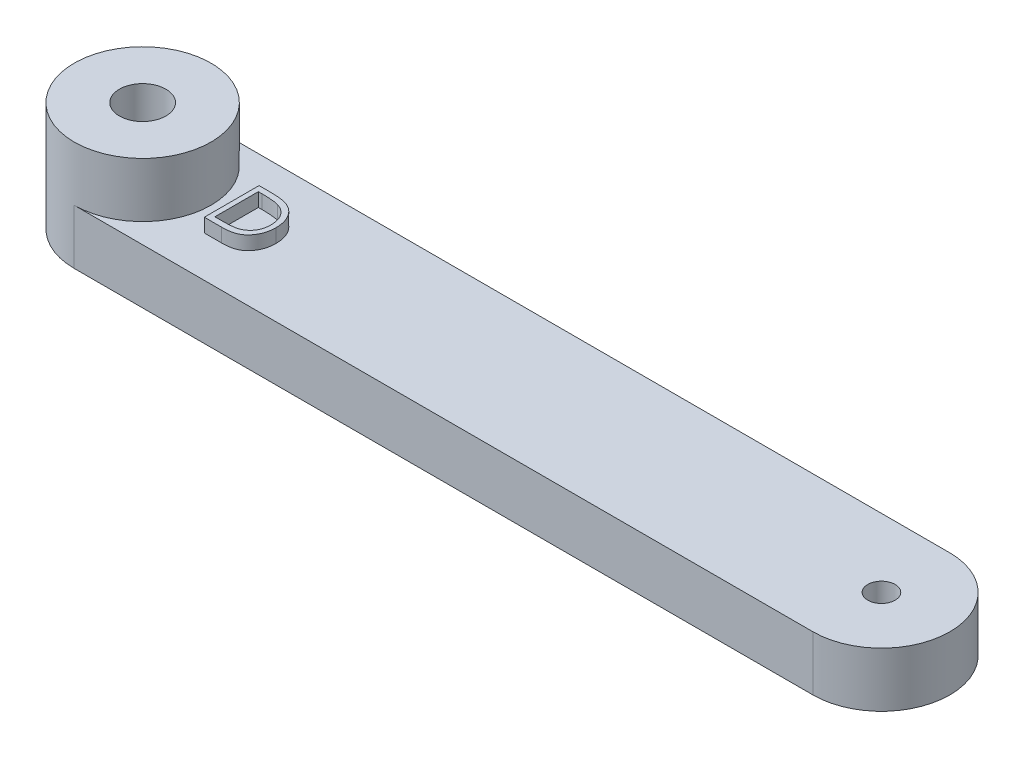
from build123d import *

# Parameters (mm, degrees)
RESSALTO_EXTRUS_O1_DEPTH = 2
ESBO_O4_R                = 2.5
RESSALTO_EXTRUS_O2_DEPTH = 2
ESBO_O2_R                = 0.85
CORTE_EXTRUS_O1_DEPTH    = 17.680827318
CORTE_EXTRUS_O2_REACH    = 18.317
ESBO_O3_R                = 0.5
RESSALTO_EXTRUS_O3_DEPTH = 0.5


with BuildPart() as part:
    # Esboço1 → Ressalto-extrusão1 (new body)
    with BuildSketch(Plane(origin=(0, 0, 0), x_dir=(1, 0, 0), z_dir=(0, 1, 0))):
        with BuildLine():
            Line((-13.5, 2.5), (13.5, 2.5))
            ThreePointArc((13.5, 2.5), (16, 0), (13.5, -2.5))
            Line((13.5, -2.5), (-13.5, -2.5))
            ThreePointArc((-13.5, -2.5), (-16, 0), (-13.5, 2.5))
        make_face()
    extrude(amount=RESSALTO_EXTRUS_O1_DEPTH)

    # Esboço4 → Ressalto-extrusão2 (add)
    with BuildSketch(Plane(origin=(0, 2, 0), x_dir=(1, 0, 0), z_dir=(0, 1, 0))):
        with Locations(Location((-13.5, 0, 0), (0, 0, 270))):
            Circle(ESBO_O4_R)
    extrude(amount=RESSALTO_EXTRUS_O2_DEPTH)

    # Esboço2 → Corte-extrusão1 (cut, through all)
    with BuildSketch(Plane(origin=(0, 4, 0), x_dir=(1, 0, 0), z_dir=(0, 1, 0))):
        with Locations(Location((-13.5, 0, 0), (0, 0, 270))):
            Circle(ESBO_O2_R)
    extrude(amount=-CORTE_EXTRUS_O1_DEPTH, mode=Mode.SUBTRACT)

    # Esboço3 → Corte-extrusão2 (cut, up to next)
    with BuildSketch(Plane(origin=(0, 2, 0), x_dir=(1, 0, 0), z_dir=(0, 1, 0)), mode=Mode.PRIVATE) as corte_extrus_o2_sk1:
        with Locations(Location((13.5, 0, 0), (0, 0, 270))):
            Circle(ESBO_O3_R)
    corte_extrus_o2_tool1 = extrude(corte_extrus_o2_sk1.sketch, amount=-CORTE_EXTRUS_O2_REACH, mode=Mode.PRIVATE) & part.part
    add(corte_extrus_o2_tool1.solids().sort_by_distance((13.5, 2, 0))[0], mode=Mode.SUBTRACT)

    # Esboço5 → Ressalto-extrusão3 (add)
    with BuildSketch(Plane(origin=(0, 2, 0), x_dir=(1, 0, 0), z_dir=(0, 1, 0))):
        with BuildLine():
            Line((-10.245767212, -1), (-10.245767212, 1))
            Line((-10.245767212, 1), (-9.841921058, 1))
            add(Edge.make_bspline(
                [(-9.841921058, 1), (-9.806795922, 0.999747103), (-9.738934342, 0.999258507), (-9.640870086, 0.996160569), (-9.550136507, 0.990680303), (-9.467032017, 0.982697717), (-9.391328467, 0.972895983), (-9.323237834, 0.960610038), (-9.262408038, 0.946102512), (-9.224996929, 0.933733683), (-9.207305673, 0.927884615)],
                knots=[0, 0, 0, 0, 1.314313732, 2.53924729, 3.670748893, 4.714932338, 5.66265055, 6.526160246, 7.303039223, 8, 8, 8, 8], degree=3))
            add(Edge.make_bspline(
                [(-9.207305673, 0.927884615), (-9.184165822, 0.919067069), (-9.138410855, 0.90163193), (-9.073263928, 0.868742615), (-9.011935149, 0.831477985), (-8.954095638, 0.789788921), (-8.901066594, 0.742495007), (-8.850776368, 0.691605244), (-8.80528224, 0.63526905), (-8.763620356, 0.574654771), (-8.726057122, 0.510476455), (-8.693406175, 0.442856393), (-8.666289607, 0.372137989), (-8.643779192, 0.298517904), (-8.626038359, 0.22183426), (-8.613934398, 0.141997765), (-8.605950975, 0.059323942), (-8.60514866, 0.003224249), (-8.604741571, -0.025240385)],
                knots=[0, 0, 0, 0, 0.984719456, 1.947108742, 2.898477687, 3.838006223, 4.779231079, 5.722358779, 6.681677486, 7.655904652, 8.64651281, 9.637519902, 10.640069247, 11.656948941, 12.698408672, 13.768548281, 14.867775369, 16, 16, 16, 16], degree=3))
            add(Edge.make_bspline(
                [(-8.604741571, -0.025240385), (-8.605100981, -0.049961092), (-8.605809236, -0.098675829), (-8.612168845, -0.170470626), (-8.621412456, -0.240135524), (-8.635723426, -0.307338781), (-8.653096291, -0.372669192), (-8.675361521, -0.435430474), (-8.700867518, -0.496198365), (-8.730610306, -0.554151209), (-8.763262526, -0.609055993), (-8.798303522, -0.660813437), (-8.83569592, -0.708684993), (-8.875796281, -0.752815628), (-8.918086405, -0.793138816), (-8.962843165, -0.829991396), (-9.010182051, -0.862652284), (-9.059891036, -0.892404918), (-9.113420253, -0.918359407), (-9.171783605, -0.940319412), (-9.235229992, -0.958517478), (-9.303603682, -0.973700847), (-9.377022812, -0.98574502), (-9.455559364, -0.993817244), (-9.539092672, -0.999276063), (-9.596452252, -0.999754002), (-9.625975545, -1)],
                knots=[0, 0, 0, 0, 1.105936401, 2.179363191, 3.223086493, 4.248585256, 5.251745608, 6.245858792, 7.225916811, 8.198733463, 9.158002045, 10.082870192, 10.993790845, 11.873723703, 12.748670949, 13.606408763, 14.465103618, 15.319838547, 16.196477973, 17.123216899, 18.106603292, 19.147568657, 20.255746949, 21.433717677, 22.679120308, 24, 24, 24, 24], degree=3))
            Line((-9.625975545, -1), (-10.245767212, -1))
        make_face()
        with BuildLine():
            Line((-10.066280032, -0.794871795), (-9.836712725, -0.794871795))
            add(Edge.make_bspline(
                [(-9.836712725, -0.794871795), (-9.803725084, -0.794730026), (-9.740277771, -0.794457351), (-9.64904463, -0.792064664), (-9.565684974, -0.788154985), (-9.490186969, -0.782683512), (-9.422593241, -0.775444303), (-9.362762527, -0.76737293), (-9.31089095, -0.757317244), (-9.279502701, -0.74820241), (-9.264997981, -0.743990385)],
                knots=[0, 0, 0, 0, 1.375205317, 2.645023457, 3.804390687, 4.853969522, 5.800190428, 6.637939096, 7.370582563, 8, 8, 8, 8], degree=3))
            add(Edge.make_bspline(
                [(-9.264997981, -0.743990385), (-9.246741774, -0.737560923), (-9.21066541, -0.724855567), (-9.158733361, -0.70167976), (-9.110300787, -0.674227149), (-9.064523629, -0.643711564), (-9.022051255, -0.609056706), (-8.982380331, -0.57101614), (-8.945590731, -0.529396269), (-8.912062555, -0.484248748), (-8.882057809, -0.435854579), (-8.85607425, -0.384689531), (-8.833301946, -0.331314211), (-8.815428464, -0.274908978), (-8.801419559, -0.215978087), (-8.79149688, -0.154517394), (-8.785317038, -0.090538376), (-8.78459621, -0.047022876), (-8.78422875, -0.024839744)],
                knots=[0, 0, 0, 0, 0.998632004, 1.973411704, 2.929992603, 3.868527914, 4.809262121, 5.754881198, 6.702106254, 7.672490631, 8.653608572, 9.636854334, 10.631411391, 11.644891563, 12.686317036, 13.754757253, 14.855430412, 16, 16, 16, 16], degree=3))
            add(Edge.make_bspline(
                [(-8.78422875, -0.024839744), (-8.784522057, -0.001449183), (-8.785098262, 0.044501779), (-8.792340725, 0.111925034), (-8.802924471, 0.17677112), (-8.818229434, 0.239044374), (-8.837732794, 0.29886629), (-8.862072589, 0.35590601), (-8.889882086, 0.410765935), (-8.922969707, 0.462179858), (-8.959207189, 0.510804492), (-8.99942312, 0.555350158), (-9.04297857, 0.595918329), (-9.089398484, 0.633140794), (-9.139991112, 0.665520037), (-9.19356465, 0.694483855), (-9.250905033, 0.719064364), (-9.290798003, 0.732138), (-9.311071699, 0.738782051)],
                knots=[0, 0, 0, 0, 1.122418816, 2.205001699, 3.251619955, 4.274784885, 5.280384055, 6.268708349, 7.249350384, 8.229342522, 9.199999885, 10.157847722, 11.105861043, 12.055065948, 13.010012805, 13.98527497, 14.976112212, 16, 16, 16, 16], degree=3))
            add(Edge.make_bspline(
                [(-9.311071699, 0.738782051), (-9.327843783, 0.74342001), (-9.363505834, 0.753281583), (-9.421699814, 0.764038939), (-9.487194185, 0.773527224), (-9.560279728, 0.781560389), (-9.640873134, 0.787324573), (-9.729036384, 0.791651038), (-9.824807586, 0.794569114), (-9.891197606, 0.794768375), (-9.925655032, 0.794871795)],
                knots=[0, 0, 0, 0, 0.674548936, 1.434276114, 2.292660221, 3.240891867, 4.284742987, 5.42552168, 6.663806718, 8, 8, 8, 8], degree=3))
            Line((-9.925655032, 0.794871795), (-10.066280032, 0.794871795))
            Line((-10.066280032, 0.794871795), (-10.066280032, -0.794871795))
        make_face(mode=Mode.SUBTRACT)
    extrude(amount=RESSALTO_EXTRUS_O3_DEPTH)


solid = part.part
